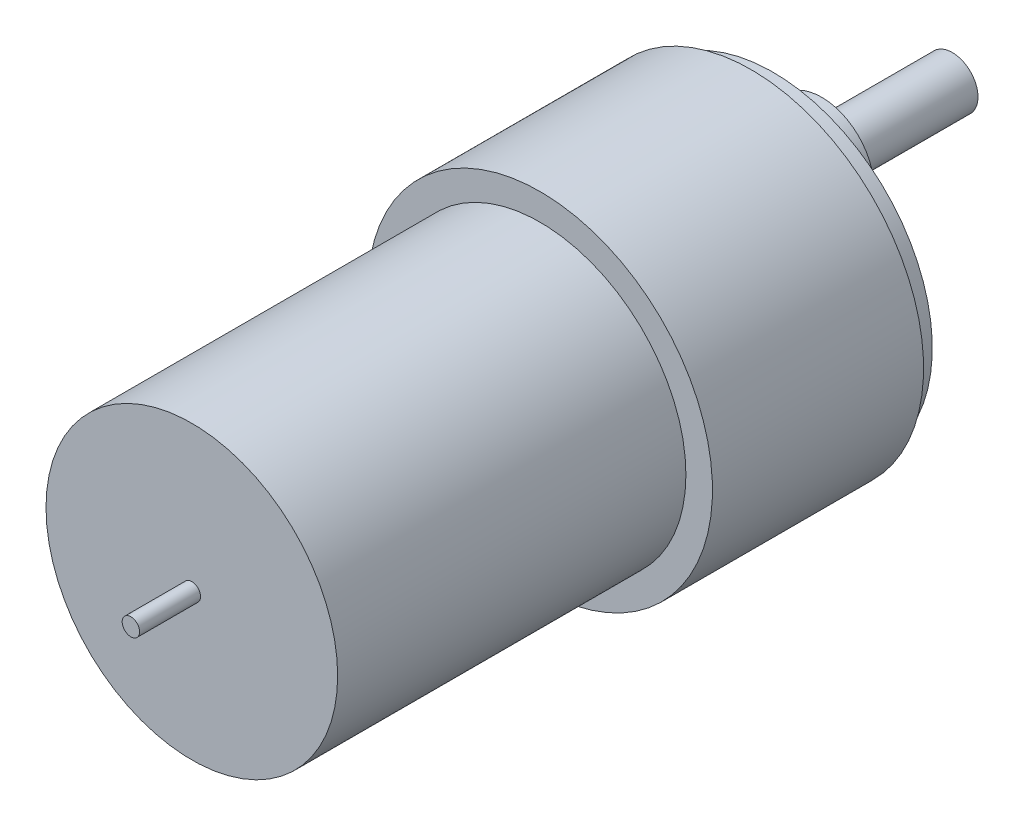
from build123d import *

# Parameters (mm, degrees)
SKETCH1_R            = 19.8
GEARBOX_DEPTH        = 24.25
SKETCH2_R            = 16.75
MOTOR_DEPTH          = 40
SKETCH3_R            = 18.3
GEARBOX_LIP_DEPTH    = 2.5
SKETCH4_R            = 6
SHAFT_HUB_DEPTH      = 5.6
SHAFT_DEPTH          = 15
SKETCH6_R            = 1.5
MNT_SCREW_HOLE_DEPTH = 4
CIRPATTERN1_COUNT    = 6
SKETCH7_R            = 1
SENSORSHAFT_DEPTH    = 7


with BuildPart() as part:
    # Sketch1 → gearbox (new body)
    with BuildSketch(Plane.XY):
        with Locations(Location((0, 0, 0), (0, 0, 180))):
            Circle(SKETCH1_R)
    extrude(amount=GEARBOX_DEPTH)

    # Sketch2 → motor (add)
    with BuildSketch(Plane.XY.offset(24.25)):
        Circle(SKETCH2_R)
    extrude(amount=MOTOR_DEPTH)

    # Sketch3 → gearbox lip (add)
    with BuildSketch(Plane(origin=(0, 0, 0), x_dir=(-1, 0, 0), z_dir=(0, 0, -1))):
        Circle(SKETCH3_R)
    extrude(amount=GEARBOX_LIP_DEPTH)

    # Sketch4 → shaft hub (add)
    with BuildSketch(Plane(origin=(0, 0, -2.5), x_dir=(-1, 0, 0), z_dir=(0, 0, -1))):
        with Locations((0, 7)):
            Circle(SKETCH4_R)
    extrude(amount=SHAFT_HUB_DEPTH)

    # Sketch5 → shaft (add)
    with BuildSketch(Plane(origin=(0, 0, -8.1), x_dir=(-1, 0, 0), z_dir=(0, 0, -1))):
        with BuildLine():
            Line((-1.71537168, 4.6), (1.71537168, 4.6))
            ThreePointArc((1.71537168, 4.6), (0, 9.95), (-1.71537168, 4.6))
        make_face()
    extrude(amount=SHAFT_DEPTH)

    # Sketch6 → mnt screw hole (cut)
    with BuildSketch(Plane(origin=(0, 0, -2.5), x_dir=(-1, 0, 0), z_dir=(0, 0, -1))):
        with Locations((-15.5, 0)):
            Circle(SKETCH6_R)
    mnt_screw_hole = extrude(amount=-MNT_SCREW_HOLE_DEPTH, mode=Mode.SUBTRACT)

    # CirPattern1: mnt screw hole ×6 about axis
    cirpattern1_axis = Axis((0, 0, 0), (0, 0, 1))
    for i in range(1, CIRPATTERN1_COUNT):
        add(mnt_screw_hole.rotate(cirpattern1_axis, i * 360 / CIRPATTERN1_COUNT), mode=Mode.SUBTRACT)

    # Sketch7 → sensorshaft (add)
    with BuildSketch(Plane.XY.offset(64.25)):
        Circle(SKETCH7_R)
    extrude(amount=SENSORSHAFT_DEPTH)


solid = part.part
